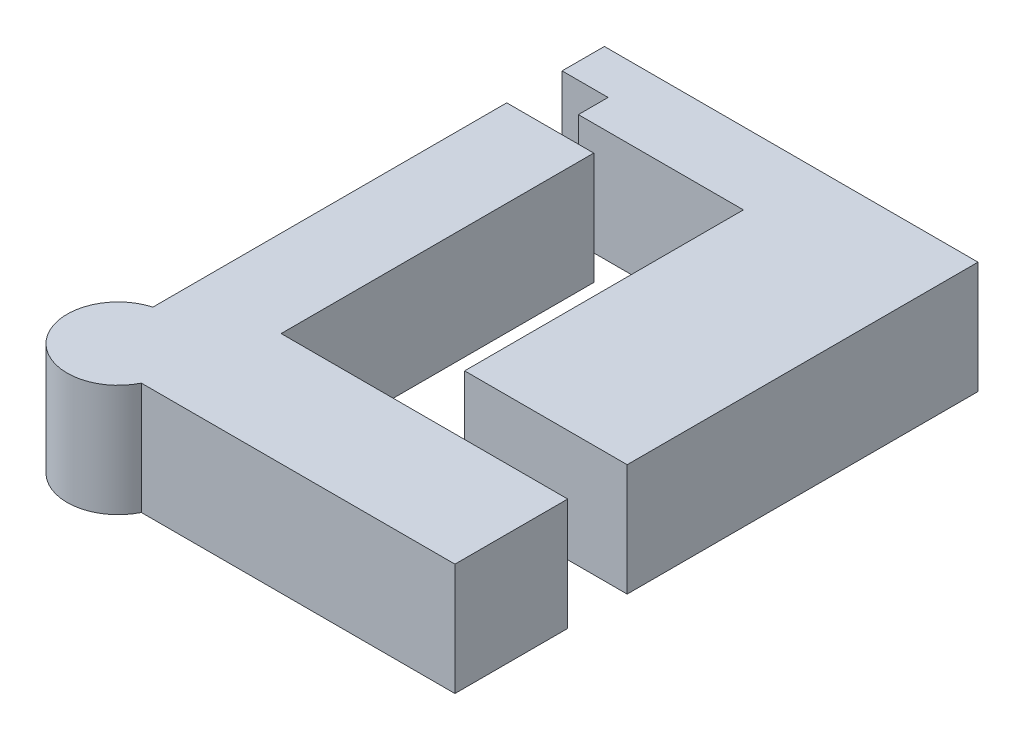
from build123d import *

# Parameters (mm, degrees)
EXTRUDE_1_DEPTH   = 30
EXTRUDE_1_2_DEPTH = 30


with BuildPart() as part:
    # 草图1 → 凸台-拉伸1 (new body)
    with BuildSketch(Plane(origin=(0, 0, 0), x_dir=(1, 0, 0), z_dir=(0, 1, 0))):
        with BuildLine():
            Line((-90.239511188, 25.288223499), (-66.947083746, 25.288223499))
            Line((-66.947083746, 25.288223499), (-66.947083746, -58.385910797))
            Line((-66.947083746, -58.385910797), (9.760488812, -58.385910797))
            Line((9.760488812, -58.385910797), (9.760488812, -88.573550981))
            Line((9.760488812, -88.573550981), (-74.167507467, -88.573550981))
            ThreePointArc((-74.167507467, -88.573550981), (-96.899000332, -91.308925643), (-90.239511188, -69.403349943))
            Line((-90.239511188, -69.403349943), (-90.239511188, 25.288223499))
        make_face()
    extrude(amount=EXTRUDE_1_DEPTH)


with BuildPart() as body_2:
    # 草图1 → Extrude 1 2 (new body)
    with BuildSketch(Plane(origin=(0, 0, 0), x_dir=(1, 0, 0), z_dir=(0, 1, 0))):
        Polygon((-90.239511188, 51.426449019), (9.760488812, 51.426449019), (9.760488812, -42.47410821), (-33.751771451, -42.47410821), (-33.751771451, 32.146759097), (-77.920740703, 32.146759097), (-77.920740703, 40.102660391), (-90.239511188, 40.102660391), align=None)
    extrude(amount=EXTRUDE_1_2_DEPTH)


solid = Compound([part.part, body_2.part])
